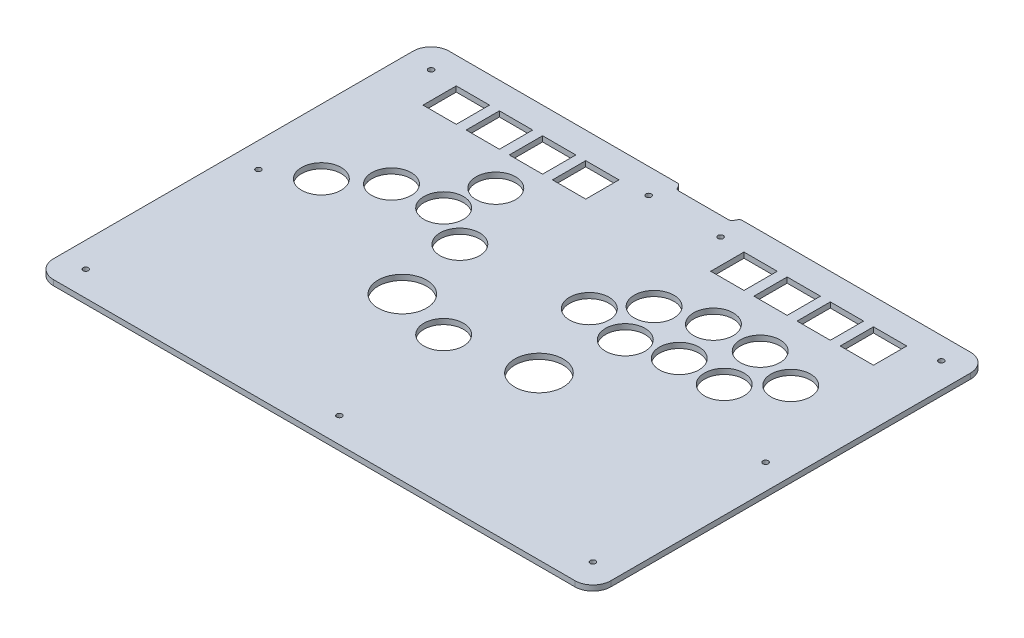
from build123d import *

# Parameters (mm, degrees)
SKETCH_1_R      = 11
SKETCH_1_R_2    = 1.5
SKETCH_1_R_3    = 13.5
SKETCH_1_W      = 18.5
SKETCH_1_H      = 18.5
EXTRUDE_1_DEPTH = 3


with BuildPart() as part:
    # 草图1 → 凸台-拉伸1 (new body)
    with BuildSketch(Plane(origin=(0, 0, 0), x_dir=(1, 0, 0), z_dir=(0, 1, 0))):
        with BuildLine():
            Line((10, 0), (136.884360712, 0))
            ThreePointArc((136.884360712, 0), (137.900113715, -0.277140216), (138.634360712, -1.031754163))
            Line((138.634360712, -1.031754163), (139.429147615, -2.468245837))
            ThreePointArc((139.429147615, -2.468245837), (140.163394612, -3.222859784), (141.179147615, -3.5))
            Line((141.179147615, -3.5), (168.820852385, -3.5))
            ThreePointArc((168.820852385, -3.5), (169.836605388, -3.222859784), (170.570852385, -2.468245837))
            Line((170.570852385, -2.468245837), (171.365639288, -1.031754163))
            ThreePointArc((171.365639288, -1.031754163), (172.099886285, -0.277140216), (173.115639288, 0))
            Line((173.115639288, 0), (300, 0))
            ThreePointArc((300, 0), (307.071067812, -2.928932188), (310, -10))
            Line((310, -10), (310, -210))
            ThreePointArc((310, -210), (307.071067812, -217.071067812), (300, -220))
            Line((300, -220), (10, -220))
            ThreePointArc((10, -220), (2.928932188, -217.071067812), (0, -210))
            Line((0, -210), (0, -10))
            ThreePointArc((0, -10), (2.928932188, -2.928932188), (10, 0))
        make_face()
        with Locations(Location((173, -85, 0), (0, 0, 270))):
            Circle(SKETCH_1_R, mode=Mode.SUBTRACT)
        with Locations(Location((190, -66, 0), (0, 0, 270))):
            Circle(SKETCH_1_R, mode=Mode.SUBTRACT)
        with Locations(Location((215, -58, 0), (0, 0, 270))):
            Circle(SKETCH_1_R, mode=Mode.SUBTRACT)
        with Locations(Location((222, -84, 0), (0, 0, 270))):
            Circle(SKETCH_1_R, mode=Mode.SUBTRACT)
        with Locations(Location((247, -84, 0), (0, 0, 270))):
            Circle(SKETCH_1_R, mode=Mode.SUBTRACT)
        with Locations(Location((241, -58, 0), (0, 0, 270))):
            Circle(SKETCH_1_R, mode=Mode.SUBTRACT)
        with Locations(Location((14, -14, 0), (0, 0, 270))):
            Circle(SKETCH_1_R_2, mode=Mode.SUBTRACT)
        with Locations(Location((14, -206, 0), (0, 0, 270))):
            Circle(SKETCH_1_R_2, mode=Mode.SUBTRACT)
        with Locations(Location((296, -206, 0), (0, 0, 270))):
            Circle(SKETCH_1_R_2, mode=Mode.SUBTRACT)
        with Locations(Location((296, -12.28568254, 0), (0, 0, 270))):
            Circle(SKETCH_1_R_2, mode=Mode.SUBTRACT)
        with Locations(Location((198, -90, 0), (0, 0, 270))):
            Circle(SKETCH_1_R, mode=Mode.SUBTRACT)
        with Locations(Location((114, -130, 0), (0, 0, 270))):
            Circle(SKETCH_1_R_3, mode=Mode.SUBTRACT)
        with Locations(Location((190, -130, 0), (0, 0, 270))):
            Circle(SKETCH_1_R_3, mode=Mode.SUBTRACT)
        with Locations(Location((155, -206, 0), (0, 0, 270))):
            Circle(SKETCH_1_R_2, mode=Mode.SUBTRACT)
        with Locations(Location((175, -14, 0), (0, 0, 270))):
            Circle(SKETCH_1_R_2, mode=Mode.SUBTRACT)
        with Locations(Location((145, -138, 0), (0, 0, 270))):
            Circle(SKETCH_1_R, mode=Mode.SUBTRACT)
        with Locations(Location((106, -90, 0), (0, 0, 270))):
            Circle(SKETCH_1_R, mode=Mode.SUBTRACT)
        with Locations(Location((84, -77, 0), (0, 0, 270))):
            Circle(SKETCH_1_R, mode=Mode.SUBTRACT)
        with Locations(Location((58, -80, 0), (0, 0, 270))):
            Circle(SKETCH_1_R, mode=Mode.SUBTRACT)
        with Locations(Location((36, -97, 0), (0, 0, 270))):
            Circle(SKETCH_1_R, mode=Mode.SUBTRACT)
        with Locations(Location((89, -53, 0), (0, 0, 270))):
            Circle(SKETCH_1_R, mode=Mode.SUBTRACT)
        with Locations(Location((266, -66, 0), (0, 0, 270))):
            Circle(SKETCH_1_R, mode=Mode.SUBTRACT)
        with Locations(Location((135, -14, 0), (0, 0, 270))):
            Circle(SKETCH_1_R_2, mode=Mode.SUBTRACT)
        with Locations(Location((296, -110, 0), (0, 0, 270))):
            Circle(SKETCH_1_R_2, mode=Mode.SUBTRACT)
        with Locations(Location((14, -110, 0), (0, 0, 270))):
            Circle(SKETCH_1_R_2, mode=Mode.SUBTRACT)
        with Locations((38, -24)):
            Rectangle(SKETCH_1_W, SKETCH_1_H, mode=Mode.SUBTRACT)
        with Locations((62, -24)):
            Rectangle(SKETCH_1_W, SKETCH_1_H, mode=Mode.SUBTRACT)
        with Locations((86, -24)):
            Rectangle(SKETCH_1_W, SKETCH_1_H, mode=Mode.SUBTRACT)
        with Locations((110, -24)):
            Rectangle(SKETCH_1_W, SKETCH_1_H, mode=Mode.SUBTRACT)
        with Locations((198, -24)):
            Rectangle(SKETCH_1_W, SKETCH_1_H, mode=Mode.SUBTRACT)
        with Locations((222, -24)):
            Rectangle(SKETCH_1_W, SKETCH_1_H, mode=Mode.SUBTRACT)
        with Locations((246, -24)):
            Rectangle(SKETCH_1_W, SKETCH_1_H, mode=Mode.SUBTRACT)
        with Locations((270, -24)):
            Rectangle(SKETCH_1_W, SKETCH_1_H, mode=Mode.SUBTRACT)
    extrude(amount=EXTRUDE_1_DEPTH)


solid = part.part
